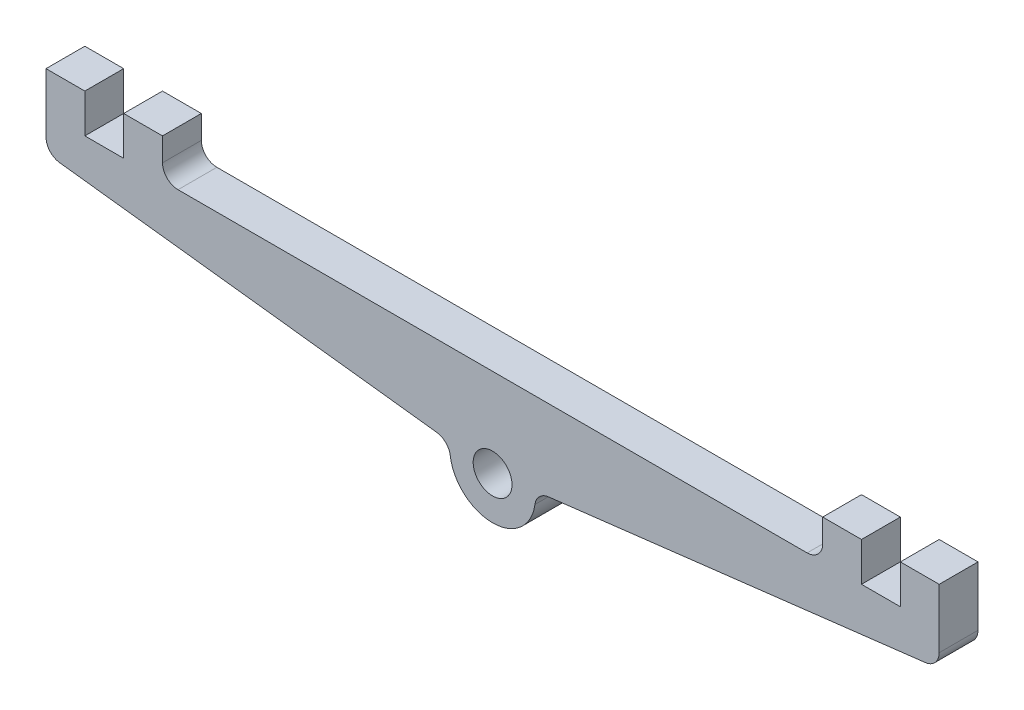
from build123d import *

# Parameters (mm, degrees)
SKETCH1_R      = 3.175
EXTRUDE1_DEPTH = 6.35


with BuildPart() as part:
    # Sketch1 → Extrude1 (new body)
    with BuildSketch(Plane.XY):
        with BuildLine():
            Line((-66.675, 8.128), (-9.141527829, 1.269026149))
            ThreePointArc((-9.141527829, 1.269026149), (-7.658129481, 0.554828765), (-6.924287371, -0.91895016))
            ThreePointArc((-6.924287371, -0.91895016), (0, -6.985), (6.924287371, -0.91895016))
            ThreePointArc((6.924287371, -0.91895016), (7.658129481, 0.554828765), (9.141527829, 1.269026149))
            Line((9.141527829, 1.269026149), (66.675, 8.128))
            Line((66.675, 8.128), (70.785682223, 8.618063624))
            ThreePointArc((70.785682223, 8.618063624), (72.384385802, 9.453807003), (73.025, 11.140203628))
            Line((73.025, 11.140203628), (73.025, 20.828))
            Line((73.025, 20.828), (66.675, 20.828))
            Line((66.675, 20.828), (66.675, 14.478))
            Line((66.675, 14.478), (60.325, 14.478))
            Line((60.325, 14.478), (60.325, 20.828))
            Line((60.325, 20.828), (53.975, 20.828))
            Line((53.975, 20.828), (53.975, 17.018))
            ThreePointArc((53.975, 17.018), (53.231051224, 15.221948776), (51.435, 14.478))
            Line((51.435, 14.478), (-51.435, 14.478))
            ThreePointArc((-51.435, 14.478), (-53.231051224, 15.221948776), (-53.975, 17.018))
            Line((-53.975, 17.018), (-53.975, 20.828))
            Line((-53.975, 20.828), (-60.325, 20.828))
            Line((-60.325, 20.828), (-60.325, 14.478))
            Line((-60.325, 14.478), (-66.675, 14.478))
            Line((-66.675, 14.478), (-66.675, 20.828))
            Line((-66.675, 20.828), (-73.025, 20.828))
            Line((-73.025, 20.828), (-73.025, 11.140203628))
            ThreePointArc((-73.025, 11.140203628), (-72.384385802, 9.453807003), (-70.785682223, 8.618063624))
            Line((-70.785682223, 8.618063624), (-66.675, 8.128))
        make_face()
        Circle(SKETCH1_R, mode=Mode.SUBTRACT)
    extrude(amount=EXTRUDE1_DEPTH)


solid = part.part
